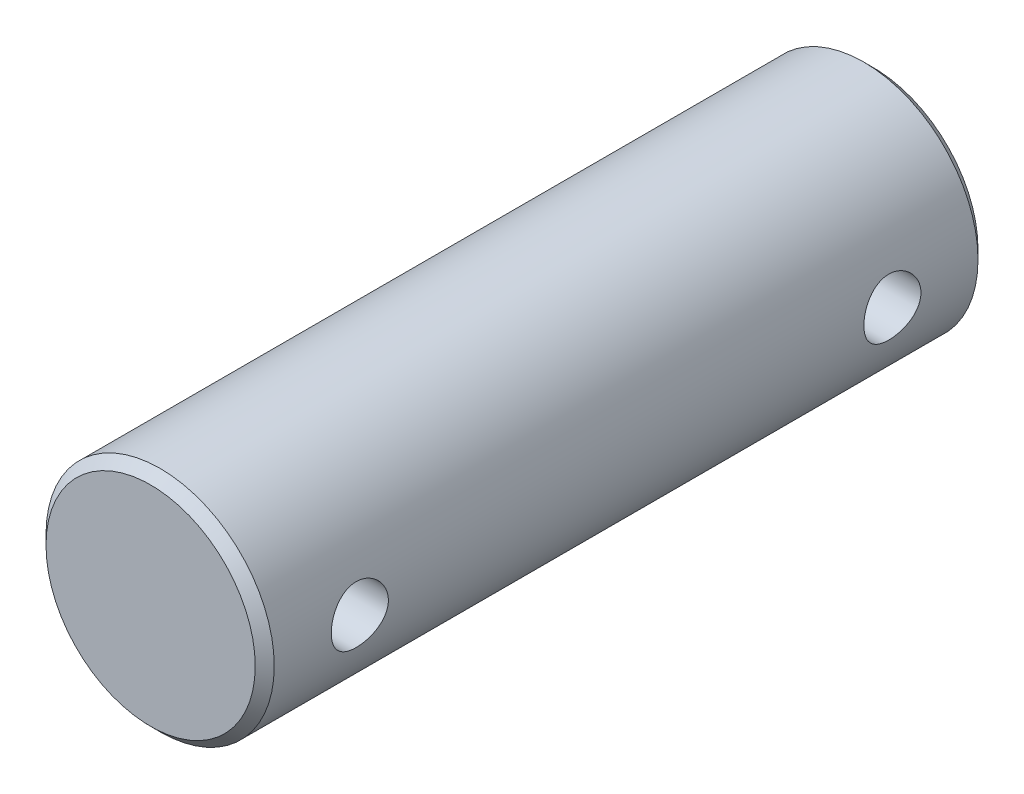
from build123d import *

# Parameters (mm, degrees)
SKETCH1_R               = 6
BOSS_EXTRUDE1_DEPTH     = 38
CUT_EXTRUDE1_DEPTH      = 39.935844668
CUT_EXTRUDE1_DEPTH_BACK = 39.935844668
SKETCH2_R               = 1.5
CHAMFER1_SIZE           = 0.5


with BuildPart() as part:
    # Sketch1 → Boss-Extrude1 (new body)
    with BuildSketch(Plane.XY):
        Circle(SKETCH1_R)
    extrude(amount=-BOSS_EXTRUDE1_DEPTH)

    # Sketch2 → Cut-Extrude1 (cut, two sides: drawn at the far end of the back side and taken through both)
    with BuildSketch(Plane(origin=(0, 0, 0), x_dir=(0, 0, -1), z_dir=(1, 0, 0)).offset(-CUT_EXTRUDE1_DEPTH_BACK)):
        with Locations((5, 0)):
            Circle(SKETCH2_R)
        with Locations((33, 0)):
            Circle(SKETCH2_R)
    extrude(amount=CUT_EXTRUDE1_DEPTH + CUT_EXTRUDE1_DEPTH_BACK, mode=Mode.SUBTRACT)

    # Chamfer1
    chamfer1_edges = [part.edges().sort_by_distance(p)[0] for p in [
        (-6, 0, 0),
        (-6, 0, -38),
    ]]
    chamfer(chamfer1_edges, length=CHAMFER1_SIZE)


solid = part.part
